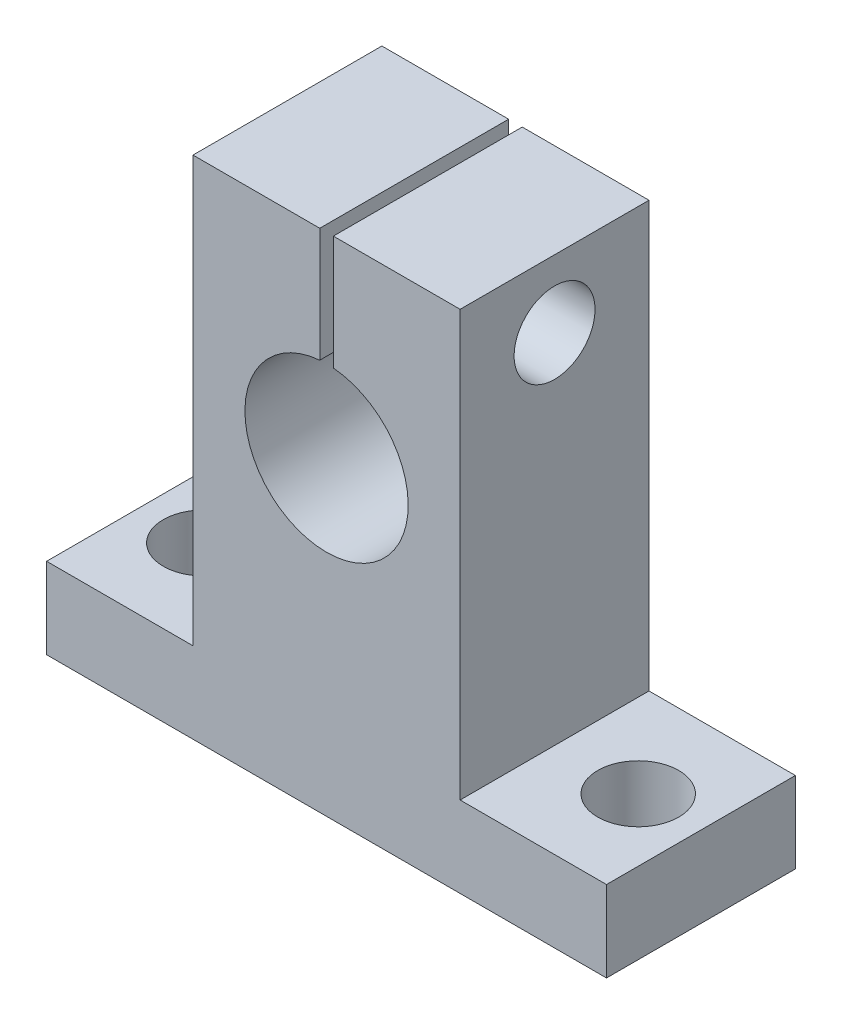
from build123d import *

# Parameters (mm, degrees)
Y_KSEKLIK_EKSTR_ZYON2_DEPTH = 14
IZIM3_R                     = 3
KES_EKSTR_ZYON1_DEPTH       = 30
IZIM4_R                     = 3
KES_EKSTR_ZYON2_DEPTH       = 41.234469053


with BuildPart() as part:
    # Çizim2 → Yükseklik-Ekstrüzyon2 (new body)
    with BuildSketch(Plane.XY):
        with BuildLine():
            Line((-0.504166667, 14.5), (-9.9, 14.5))
            Line((-9.9, 14.5), (-9.9, -17))
            Line((-9.9, -17), (-20.75, -17))
            Line((-20.75, -17), (-20.75, -23))
            Line((-20.75, -23), (20.75, -23))
            Line((20.75, -23), (20.75, -17))
            Line((20.75, -17), (9.9, -17))
            Line((9.9, -17), (9.9, 14.5))
            Line((9.9, 14.5), (0.504166667, 14.5))
            Line((0.504166667, 14.5), (0.504166667, 6.028956458))
            ThreePointArc((0.504166667, 6.028956458), (0, -6.05), (-0.504166667, 6.028956458))
            Line((-0.504166667, 6.028956458), (-0.504166667, 14.5))
        make_face()
    extrude(amount=-Y_KSEKLIK_EKSTR_ZYON2_DEPTH)

    # Çizim3 → Kes-Ekstrüzyon1 (cut)
    with BuildSketch(Plane.ZY.offset(9.9)):
        with Locations(Location((-7, 9.5, 0), (0, 0, 270))):
            Circle(IZIM3_R)
    extrude(amount=-KES_EKSTR_ZYON1_DEPTH, mode=Mode.SUBTRACT)

    # Çizim4 → Kes-Ekstrüzyon2 (cut, through all)
    with BuildSketch(Plane(origin=(0, -17, 0), x_dir=(1, 0, 0), z_dir=(0, 1, 0))):
        with Locations(Location((-16.1, 7, 0), (0, 0, 180))):
            Circle(IZIM4_R)
        with Locations((16.1, 7)):
            Circle(IZIM4_R)
    extrude(amount=-KES_EKSTR_ZYON2_DEPTH, mode=Mode.SUBTRACT)


solid = part.part
